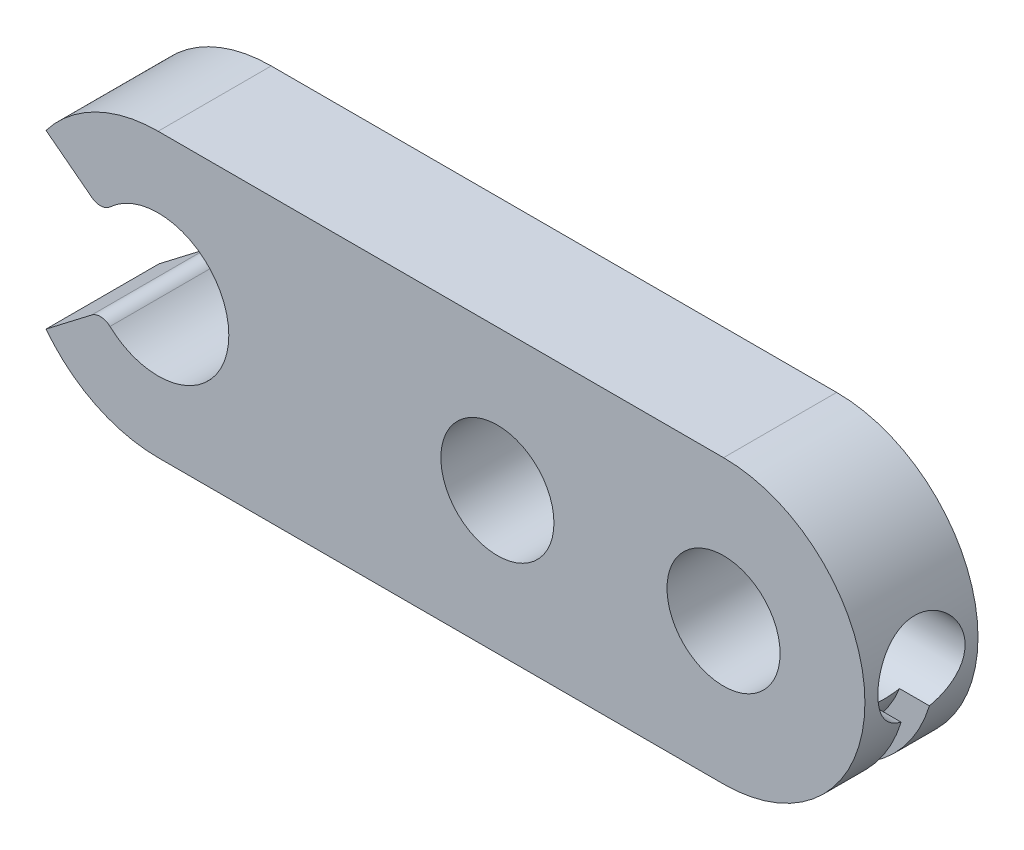
from build123d import *

# Parameters (mm, degrees)
BOSS_EXTRUDE1_DEPTH = 4
FILLET1_R           = 0.5
SKETCH2_R           = 2
CUT_EXTRUDE1_DEPTH  = 10
SKETCH3_R           = 2
CUT_EXTRUDE2_DEPTH  = 4
CUT_EXTRUDE3_START  = 50
SKETCH4_R           = 1.54375
CUT_EXTRUDE3_DEPTH  = 30
CUT_EXTRUDE4_START  = -2
CUT_EXTRUDE4_DEPTH  = 0.5


with BuildPart() as part:
    # Sketch1 → Boss-Extrude1 (new body)
    with BuildSketch(Plane.XY):
        with BuildLine():
            Line((-3.966766701, 3.043807145), (-1.983383351, 1.521903573))
            ThreePointArc((-1.983383351, 1.521903573), (2.5, 0), (-1.983383351, -1.521903573))
            Line((-1.983383351, -1.521903573), (-3.966766701, -3.043807145))
            ThreePointArc((-3.966766701, -3.043807145), (-2.211443451, -4.484363708), (0, -5))
            Line((0, -5), (20, -5))
            ThreePointArc((20, -5), (25, 0), (20, 5))
            Line((20, 5), (0, 5))
            ThreePointArc((0, 5), (-2.211443451, 4.484363708), (-3.966766701, 3.043807145))
        make_face()
    extrude(amount=BOSS_EXTRUDE1_DEPTH)

    # Fillet1
    fillet1_edges = [part.edges().sort_by_distance(p)[0] for p in [
        (-1.983383351, -1.521903573, 2),
        (-1.983383351, 1.521903573, 2),
    ]]
    fillet(fillet1_edges, radius=FILLET1_R)

    # Sketch2 → Cut-Extrude1 (cut)
    with BuildSketch(Plane.XY.offset(4)):
        with Locations((20, 0)):
            Circle(SKETCH2_R)
    extrude(amount=-CUT_EXTRUDE1_DEPTH, mode=Mode.SUBTRACT)

    # Sketch3 → Cut-Extrude2 (cut)
    with BuildSketch(Plane.XY.offset(4)):
        with Locations((12, 0)):
            Circle(SKETCH3_R)
    extrude(amount=-CUT_EXTRUDE2_DEPTH, mode=Mode.SUBTRACT)

    # Sketch4 → Cut-Extrude3 (cut)
    with BuildSketch(Plane(origin=(0, 0, 0), x_dir=(0, 0, -1), z_dir=(1, 0, 0)).offset(CUT_EXTRUDE3_START)):
        with Locations((-2, 0)):
            Circle(SKETCH4_R)
    extrude(amount=-CUT_EXTRUDE3_DEPTH, mode=Mode.SUBTRACT)

    # Sketch5 → Cut-Extrude4 (cut, symmetric)
    with BuildSketch(Plane(origin=(0, 0, 0), x_dir=(-1, 0, 0), z_dir=(0, 0, -1)).offset(CUT_EXTRUDE4_START)):
        with BuildLine():
            Line((-24, 0), (-25, 0))
            ThreePointArc((-25, 0), (-23.535533906, -3.535533906), (-20, -5))
            Line((-20, -5), (0, -5))
            Line((0, -5), (3, -5))
            Line((3, -5), (3, -4))
            Line((3, -4), (-20, -4))
            ThreePointArc((-20, -4), (-22.828427125, -2.828427125), (-24, 0))
        make_face()
    extrude(amount=CUT_EXTRUDE4_DEPTH, both=True, mode=Mode.SUBTRACT)


solid = part.part
